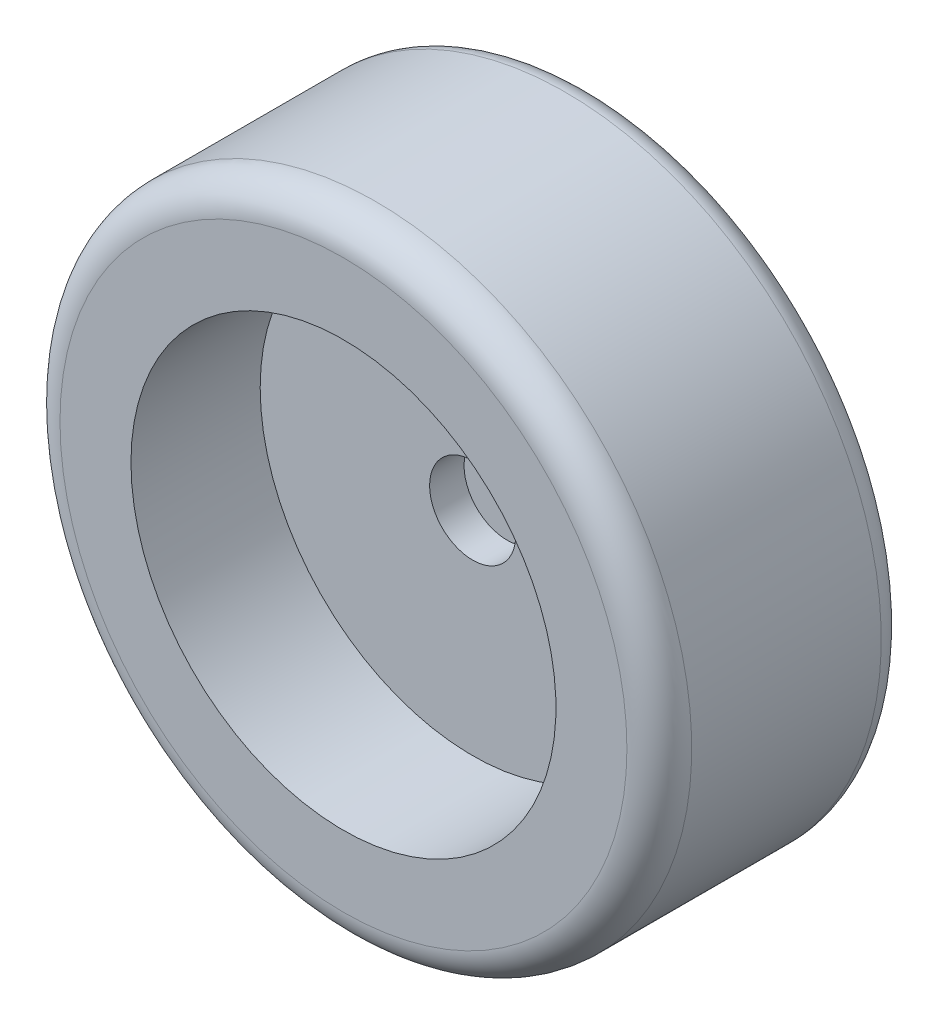
from build123d import *


with BuildPart() as part:
    # Sketch1 → Revolve1 (revolve)
    with BuildSketch(Plane.XZ, mode=Mode.PRIVATE) as revolve1_sk:
        with BuildLine():
            Line((7.5, 14.5), (0, 14.5))
            Line((0, 14.5), (0, 0))
            Line((0, 0), (50.64325479, 0))
            ThreePointArc((50.64325479, 0), (53.723938872, 1.276061128), (55, 4.35674521))
            Line((55, 4.35674521), (55, 37.35674521))
            ThreePointArc((55, 37.35674521), (53.34712894, 41.34712894), (49.35674521, 43))
            Line((49.35674521, 43), (37, 43))
            Line((37, 43), (37, 20.5))
            Line((37, 20.5), (7.5, 20.5))
            Line((7.5, 20.5), (7.5, 14.5))
        make_face()
    revolve(revolve1_sk.sketch.rotate(Axis((0, 0, 43), (0, 0, -1)), 180), axis=Axis((0, 0, 43), (0, 0, -1)))


solid = part.part
